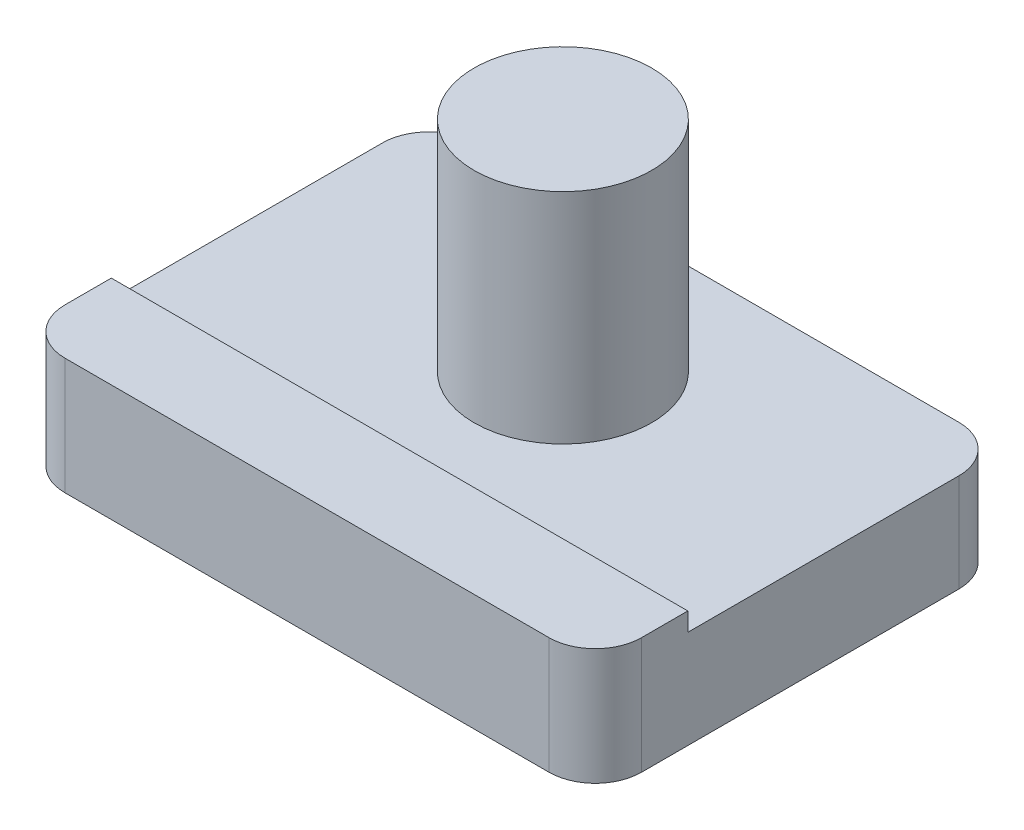
from build123d import *

# Parameters (mm, degrees)
SKETCH_1_W      = 62.3
SKETCH_1_H      = 34.3
EXTRUDE_1_DEPTH = 10.6
SKETCH_1_3_W    = 62.3
SKETCH_1_3_H    = 10
EXTRUDE_2_DEPTH = 12.6
SKETCH_4_R      = 9.593725323
EXTRUDE_3_DEPTH = 23.62
FILLET_1_R      = 5


with BuildPart() as part:
    # 草图1 → 凸台-拉伸1 (new body)
    with BuildSketch(Plane(origin=(0, 0, 0), x_dir=(1, 0, 0), z_dir=(0, 1, 0))):
        with Locations((0, 5)):
            Rectangle(SKETCH_1_W, SKETCH_1_H)
    extrude(amount=EXTRUDE_1_DEPTH)

    # 草图1<3> → 凸台-拉伸2 (add)
    with BuildSketch(Plane(origin=(0, 0, 0), x_dir=(1, 0, 0), z_dir=(0, 1, 0))):
        with Locations((0, -17.15)):
            Rectangle(SKETCH_1_3_W, SKETCH_1_3_H)
    extrude(amount=EXTRUDE_2_DEPTH)

    # 草图4 → 凸台-拉伸3 (add)
    with BuildSketch(Plane(origin=(0, 10.6, 0), x_dir=(1, 0, 0), z_dir=(0, 1, 0))):
        with Locations((0, 5.500207834)):
            Circle(SKETCH_4_R)
    extrude(amount=EXTRUDE_3_DEPTH)

    # 圆角1
    fillet_1_edges = [part.edges().sort_by_distance(p)[0] for p in [
        (-31.15, 6.3, 22.15),
        (-31.15, 5.3, -22.15),
        (31.15, 6.3, 22.15),
        (31.15, 5.3, -22.15),
    ]]
    fillet(fillet_1_edges, radius=FILLET_1_R)


solid = part.part
